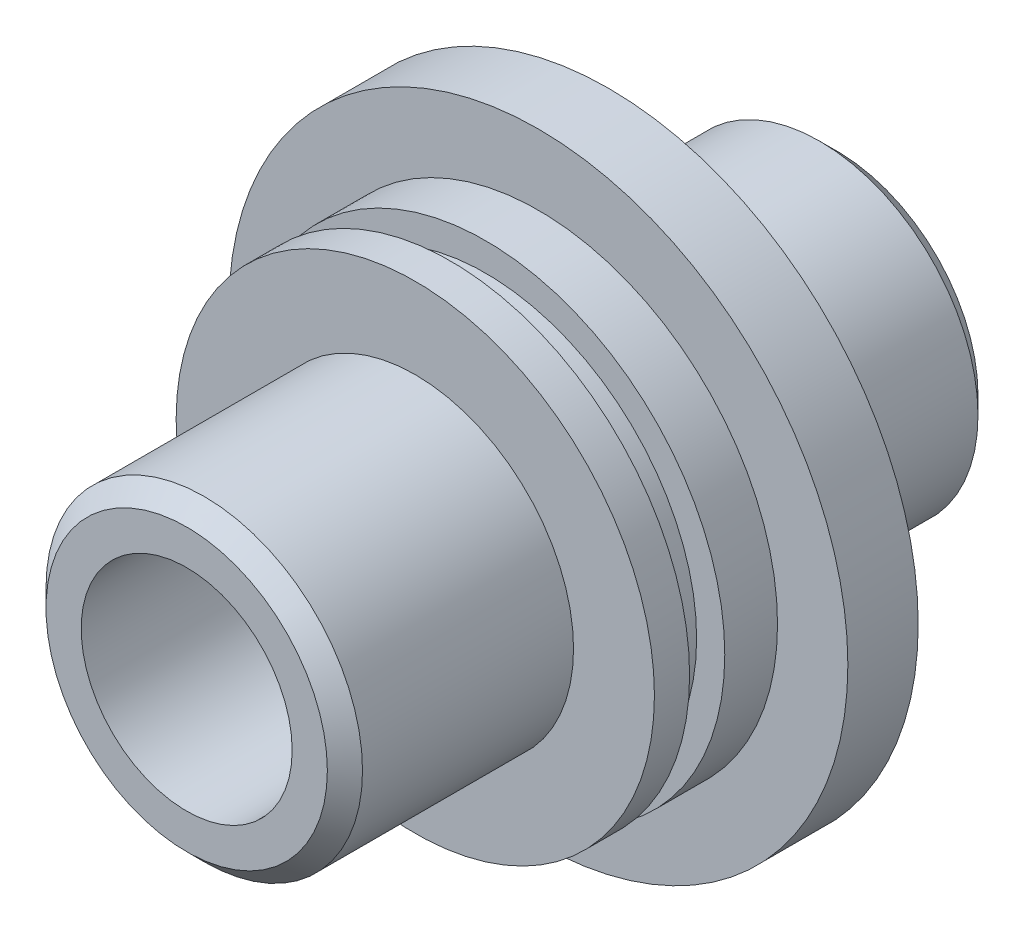
from build123d import *

# Parameters (mm, degrees)
SKETCH1_R           = 8.8
SKETCH1_R_2         = 3
BOSS_EXTRUDE1_DEPTH = 18.5
SKETCH2_OUTSIDE_W   = 25.802
SKETCH2_OUTSIDE_H   = 25.802
SKETCH2_OUTSIDE_R   = 4.5
CUT_EXTRUDE1_DEPTH  = 6.5
SKETCH3_OUTSIDE_W   = 25.802
SKETCH3_OUTSIDE_H   = 25.802
SKETCH3_OUTSIDE_R   = 4.5
CUT_EXTRUDE2_DEPTH  = 6.5
SKETCH4_OUTSIDE_W   = 25.802
SKETCH4_OUTSIDE_H   = 25.802
SKETCH4_OUTSIDE_R   = 6.8
CUT_EXTRUDE3_DEPTH  = 3.5
CUT_EXTRUDE4_START  = -1
SKETCH5_OUTSIDE_W   = 25.802
SKETCH5_OUTSIDE_H   = 25.802
SKETCH5_OUTSIDE_R   = 6
CUT_EXTRUDE4_DEPTH  = 1
CHAMFER1_SIZE       = 0.5


with BuildPart() as part:
    # Sketch1 → Boss-Extrude1 (new body)
    with BuildSketch(Plane.XY):
        Circle(SKETCH1_R)
        Circle(SKETCH1_R_2, mode=Mode.SUBTRACT)
    extrude(amount=BOSS_EXTRUDE1_DEPTH)

    # Sketch2 outside → Cut-Extrude1 (cut)
    with BuildSketch(Plane.XY.offset(18.5)):
        Rectangle(SKETCH2_OUTSIDE_W, SKETCH2_OUTSIDE_H)
        Circle(SKETCH2_OUTSIDE_R, mode=Mode.SUBTRACT)
    extrude(amount=-CUT_EXTRUDE1_DEPTH, mode=Mode.SUBTRACT)

    # Sketch3 outside → Cut-Extrude2 (cut)
    with BuildSketch(Plane(origin=(0, 0, 0), x_dir=(-1, 0, 0), z_dir=(0, 0, -1))):
        Rectangle(SKETCH3_OUTSIDE_W, SKETCH3_OUTSIDE_H)
        with Locations(Location((0, 0, 0), (0, 0, 180))):
            Circle(SKETCH3_OUTSIDE_R, mode=Mode.SUBTRACT)
    extrude(amount=-CUT_EXTRUDE2_DEPTH, mode=Mode.SUBTRACT)

    # Sketch4 outside → Cut-Extrude3 (cut)
    with BuildSketch(Plane.XY.offset(12)):
        Rectangle(SKETCH4_OUTSIDE_W, SKETCH4_OUTSIDE_H)
        Circle(SKETCH4_OUTSIDE_R, mode=Mode.SUBTRACT)
    extrude(amount=-CUT_EXTRUDE3_DEPTH, mode=Mode.SUBTRACT)

    # Sketch5 outside → Cut-Extrude4 (cut)
    with BuildSketch(Plane.XY.offset(12).offset(CUT_EXTRUDE4_START)):
        Rectangle(SKETCH5_OUTSIDE_W, SKETCH5_OUTSIDE_H)
        Circle(SKETCH5_OUTSIDE_R, mode=Mode.SUBTRACT)
    extrude(amount=-CUT_EXTRUDE4_DEPTH, mode=Mode.SUBTRACT)

    # Chamfer1
    chamfer1_edges = [part.edges().sort_by_distance(p)[0] for p in [
        (-4.5, 0, 18.5),
        (-4.5, 0, 0),
    ]]
    chamfer(chamfer1_edges, length=CHAMFER1_SIZE)


solid = part.part
